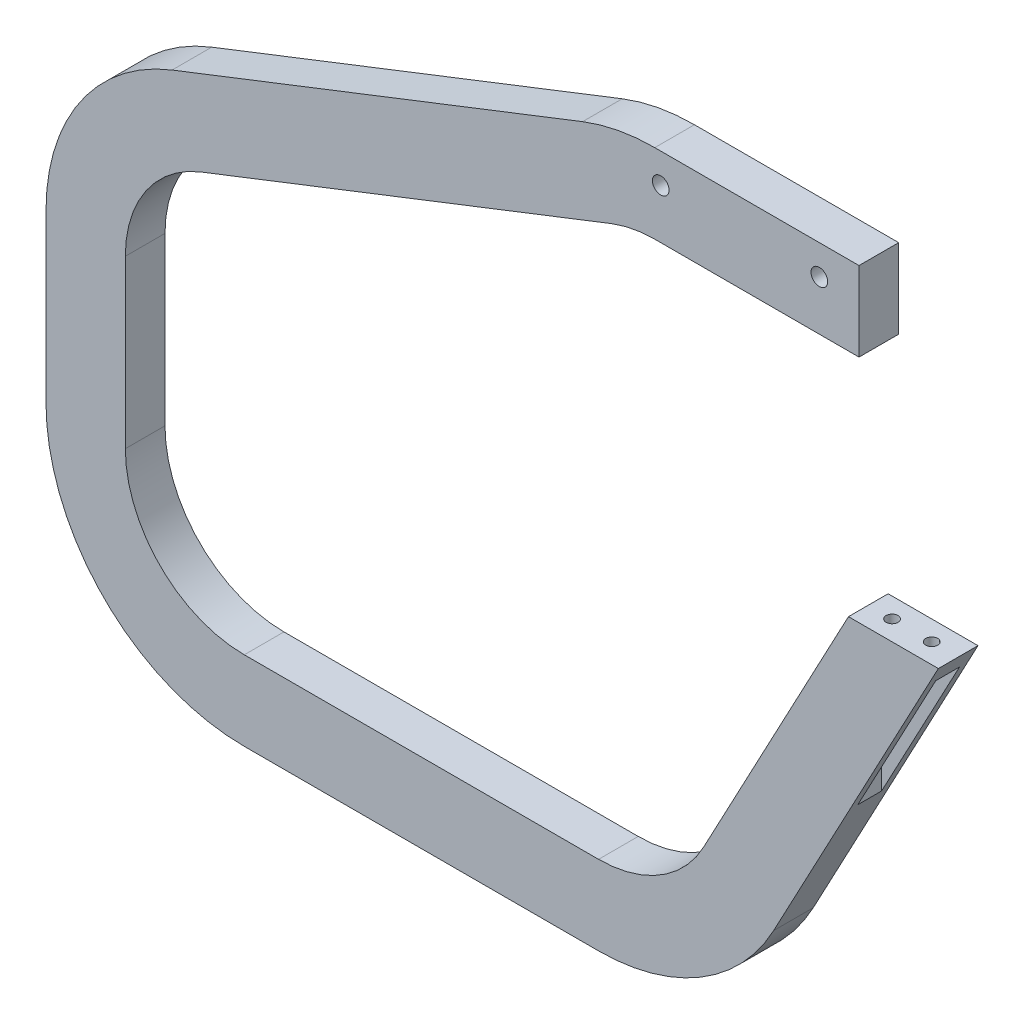
from build123d import *

# Parameters (mm, degrees)
SKETCH_1_R               = 2.1
EXTRUDE_1_DEPTH          = 10
CUT_EXTRUDE_1_DEPTH      = 3
CUT_EXTRUDE_1_DEPTH_BACK = 3
SKETCH_5_R               = 1.5
CUT_EXTRUDE_2_DEPTH      = 5


with BuildPart() as part:
    # 草图1 → 凸台-拉伸1 (new body)
    with BuildSketch(Plane.XY):
        with BuildLine():
            Line((-387.930073268, -240), (-298.601858772, -240))
            ThreePointArc((-298.601858772, -240), (-272.863892205, -232.866736253), (-254.469753791, -213.50228308))
            Line((-254.469753791, -213.50228308), (-212.930073268, -135.499923245))
            Line((-212.930073268, -135.499923245), (-235.589314209, -135.499923245))
            Line((-235.589314209, -135.499923245), (-272.122595783, -204.101369848))
            ThreePointArc((-272.122595783, -204.101369848), (-283.159078832, -215.720041752), (-298.601858772, -220))
            Line((-298.601858772, -220), (-387.930073268, -220))
            ThreePointArc((-387.930073268, -220), (-409.143276704, -211.213203436), (-417.930073268, -190))
            Line((-417.930073268, -190), (-417.930073268, -147.979949055))
            ThreePointArc((-417.930073268, -147.979949055), (-412.707094466, -131.065481267), (-398.856791899, -120.040607259))
            Line((-398.856791899, -120.040607259), (-295.350394851, -79.56058145))
            ThreePointArc((-295.350394851, -79.56058145), (-289.983341054, -78.019588665), (-284.42367622, -77.499923245))
            Line((-284.42367622, -77.499923245), (-232.930073268, -77.499923245))
            Line((-232.930073268, -77.499923245), (-232.930073268, -57.5))
            Line((-232.930073268, -57.5), (-284.423872481, -57.5))
            ThreePointArc((-284.423872481, -57.5), (-293.689980537, -58.366109034), (-302.635070198, -60.934430341))
            Line((-302.635070198, -60.934430341), (-406.141270986, -101.414379396))
            ThreePointArc((-406.141270986, -101.414379396), (-429.225108599, -119.789169409), (-437.930073268, -147.979949055))
            Line((-437.930073268, -147.979949055), (-437.930073268, -190))
            ThreePointArc((-437.930073268, -190), (-423.285412328, -225.355339059), (-387.930073268, -240))
        make_face()
        with Locations((-242.930073268, -65)):
            Circle(SKETCH_1_R, mode=Mode.SUBTRACT)
        with Locations((-282.930073268, -65)):
            Circle(SKETCH_1_R, mode=Mode.SUBTRACT)
    extrude(amount=EXTRUDE_1_DEPTH)

    # 草图4 → 切除-拉伸1 (cut, two sides: drawn at the far end of the back side and taken through both)
    with BuildSketch(Plane.XY.offset(5).offset(-CUT_EXTRUDE_1_DEPTH_BACK)):
        Polygon((-235.239731933, -167.152806322), (-235.239731933, -177.392542568), (-215.592792743, -140.499923245), (-230.589314209, -140.499923245), (-235.239731933, -140.499923245), align=None)
    extrude(amount=CUT_EXTRUDE_1_DEPTH + CUT_EXTRUDE_1_DEPTH_BACK, mode=Mode.SUBTRACT)

    # 草图5 → 切除-拉伸2 (cut)
    with BuildSketch(Plane.XZ.offset(140.499923245)):
        with Locations((-229.592792743, 5)):
            Circle(SKETCH_5_R)
        with Locations((-219.592792743, 5)):
            Circle(SKETCH_5_R)
    extrude(amount=-CUT_EXTRUDE_2_DEPTH, mode=Mode.SUBTRACT)


solid = part.part
